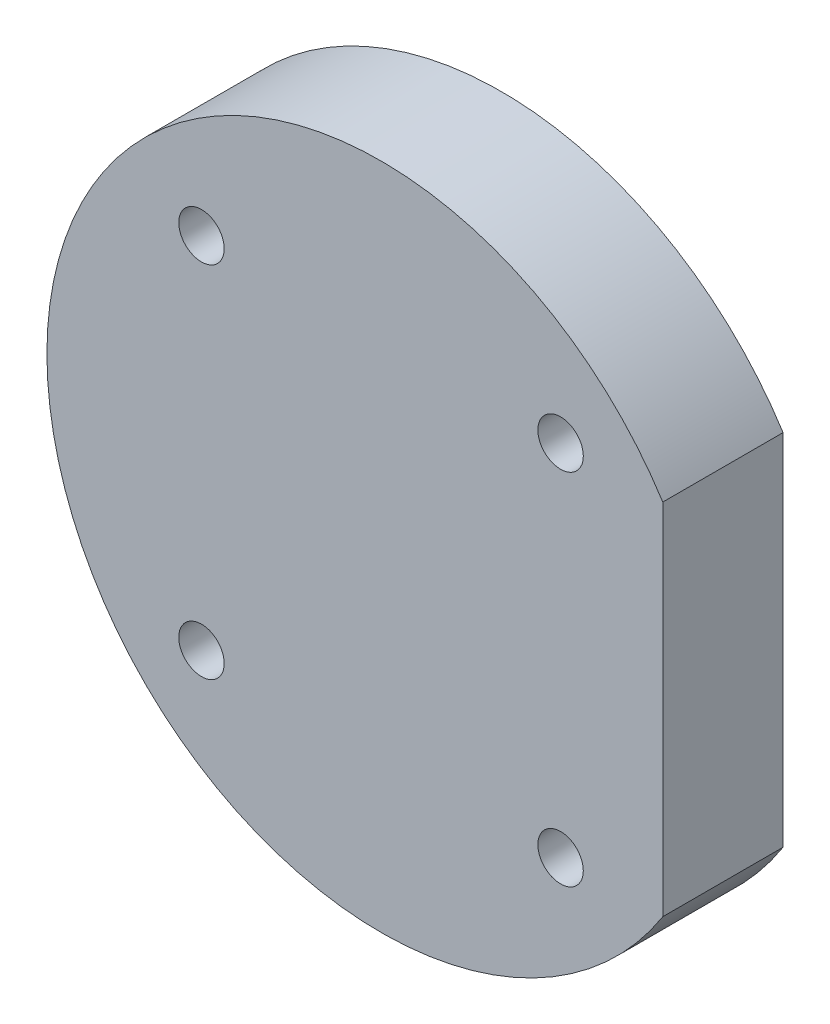
from build123d import *

# Parameters (mm, degrees)
ESQUISSE1_R             = 25
ESQUISSE1_R_2           = 1.7
BOSS_EXTRU_1_DEPTH      = 9
ESQUISSE6_R             = 11
ENL_V_MAT_EXTRU_2_DEPTH = 6
CONG_2_R                = 0.5
ESQUISSE15_W            = 7.963879273
ESQUISSE15_H            = 27.450042448
ENL_V_MAT_EXTRU_4_DEPTH = 37.482872694
ESQUISSE16_W            = 21.21339198
ESQUISSE16_H            = 6
ENL_V_MAT_EXTRU_5_DEPTH = 6


with BuildPart() as part:
    # Esquisse1 → Boss.-Extru.1 (new body)
    with BuildSketch(Plane.XY):
        Circle(ESQUISSE1_R)
        with Locations((-13.435028843, 13.435028843)):
            Circle(ESQUISSE1_R_2, mode=Mode.SUBTRACT)
        with Locations((13.435028843, 13.435028843)):
            Circle(ESQUISSE1_R_2, mode=Mode.SUBTRACT)
        with Locations((13.435028843, -13.435028843)):
            Circle(ESQUISSE1_R_2, mode=Mode.SUBTRACT)
        with Locations((-13.435028843, -13.435028843)):
            Circle(ESQUISSE1_R_2, mode=Mode.SUBTRACT)
    extrude(amount=BOSS_EXTRU_1_DEPTH)

    # Esquisse6 → Enlèv. mat.-Extru.2 (cut)
    with BuildSketch(Plane(origin=(0, 0, 0), x_dir=(-1, 0, 0), z_dir=(0, 0, -1))):
        Circle(ESQUISSE6_R)
    extrude(amount=-ENL_V_MAT_EXTRU_2_DEPTH, mode=Mode.SUBTRACT)

    # Congé2
    cong_2_edges = [part.edges().sort_by_distance(p)[0] for p in [
        (11, 0, 6),
    ]]
    fillet(cong_2_edges, radius=CONG_2_R)

    # Esquisse15 → Enlèv. mat.-Extru.4 (cut, through all)
    with BuildSketch(Plane(origin=(0, 0, 0), x_dir=(-1, 0, 0), z_dir=(0, 0, -1))):
        with Locations((-25.065108278, -0.289992381)):
            Rectangle(ESQUISSE15_W, ESQUISSE15_H)
    extrude(amount=-ENL_V_MAT_EXTRU_4_DEPTH, mode=Mode.SUBTRACT)

    # Esquisse16 → Enlèv. mat.-Extru.5 (cut)
    with BuildSketch(Plane(origin=(0, 0, 0), x_dir=(-1, 0, 0), z_dir=(0, 0, -1))):
        with Locations((17.506358801, 0)):
            Rectangle(ESQUISSE16_W, ESQUISSE16_H)
    extrude(amount=-ENL_V_MAT_EXTRU_5_DEPTH, mode=Mode.SUBTRACT)


solid = part.part
